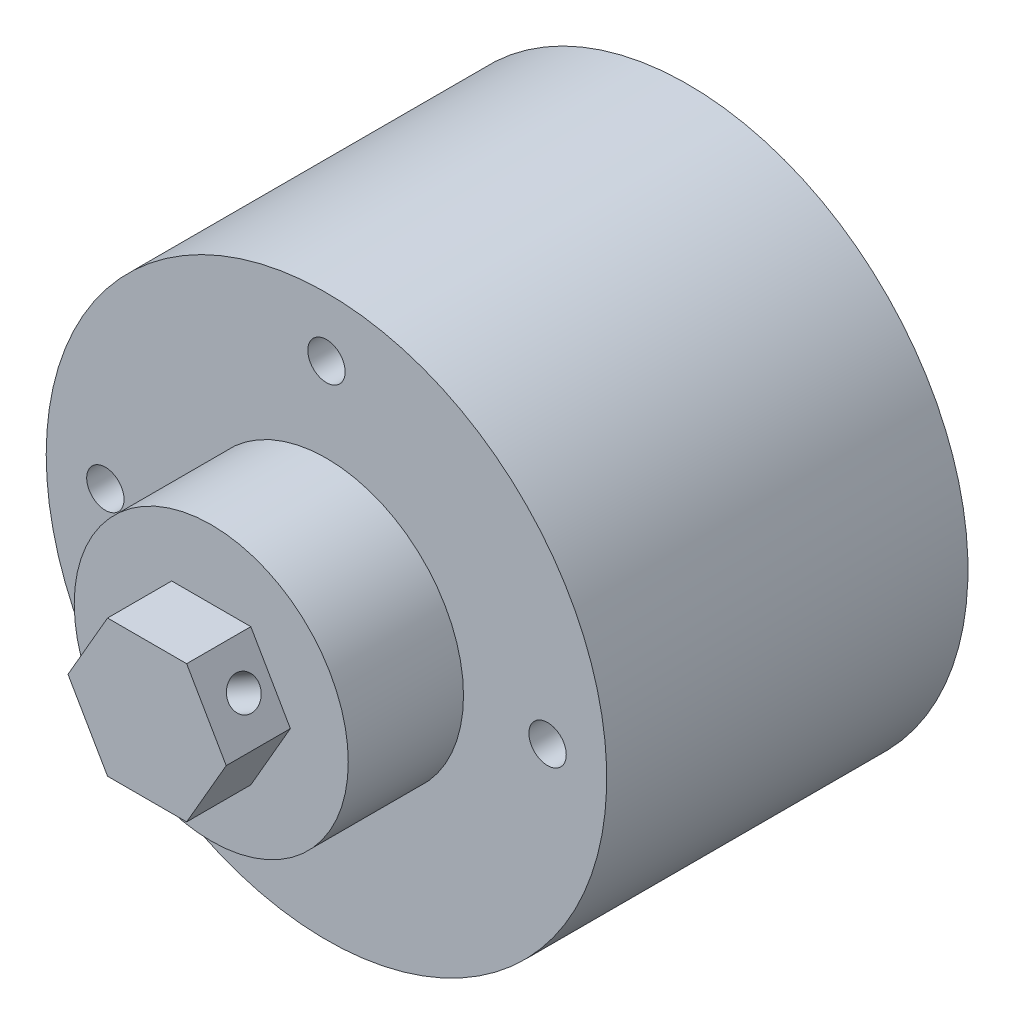
from build123d import *

# Parameters (mm, degrees)
CROQUIS1_R              = 45
SALIENTE_EXTRUIR1_DEPTH = 58
CROQUIS2_R              = 22
SALIENTE_EXTRUIR2_DEPTH = 18.5
SALIENTE_EXTRUIR3_DEPTH = 10.3
CROQUIS4_R              = 2.5
CORTAR_EXTRUIR1_DEPTH   = 115.269878576
CROQUIS5_R              = 3
CORTAR_EXTRUIR2_DEPTH   = 10


with BuildPart() as part:
    # Croquis1 → Saliente-Extruir1 (new body)
    with BuildSketch(Plane.XY):
        with Locations(Location((0, 0, 0), (0, 0, 180))):
            Circle(CROQUIS1_R)
    extrude(amount=SALIENTE_EXTRUIR1_DEPTH)

    # Croquis2 → Saliente-Extruir2 (add)
    with BuildSketch(Plane.XY.offset(58)):
        Circle(CROQUIS2_R)
    extrude(amount=SALIENTE_EXTRUIR2_DEPTH)

    # Croquis3 → Saliente-Extruir3 (add)
    with BuildSketch(Plane.XY.offset(76.5)):
        Polygon((12.701705922, 0), (6.350852961, 11), (-6.350852961, 11), (-12.701705922, 0), (-6.350852961, -11), (6.350852961, -11), align=None)
    extrude(amount=SALIENTE_EXTRUIR3_DEPTH)

    # Croquis4 → Cortar-Extruir1 (cut, through all)
    with BuildSketch(Plane(origin=(9.526279442, 5.5, 0), x_dir=(0, 0, -1), z_dir=(0.8660254037844384, 0.5000000000000003, 0))):
        with Locations(Location((-80.8, 0, 0), (0, 0, 90))):
            Circle(CROQUIS4_R)
    extrude(amount=-CORTAR_EXTRUIR1_DEPTH, mode=Mode.SUBTRACT)

    # Croquis5 → Cortar-Extruir2 (cut)
    with BuildSketch(Plane.XY.offset(58)):
        with Locations((-35.5, 0)):
            Circle(CROQUIS5_R)
        with Locations((35.5, 0)):
            Circle(CROQUIS5_R)
        with Locations((0, 35.5)):
            Circle(CROQUIS5_R)
    extrude(amount=-CORTAR_EXTRUIR2_DEPTH, mode=Mode.SUBTRACT)


solid = part.part
